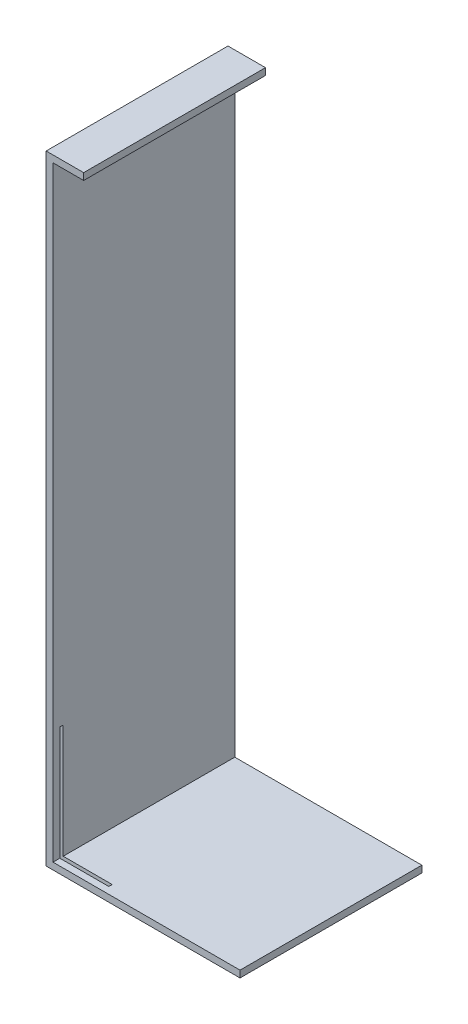
from build123d import *

# Parameters (mm, degrees)
BOSS_EXTRUDE1_DEPTH = 80
SKETCH2_W           = 1.5
SKETCH2_H           = 50
CUT_EXTRUDE1_DEPTH  = 1.5
CUT_EXTRUDE3_DEPTH  = 1.5


with BuildPart() as part:
    # Sketch1 → Boss-Extrude1 (new body)
    with BuildSketch(Plane.XY):
        Polygon((0, 220.664977974), (0, -51.835022026), (85.3, -51.835022026), (85.3, -48.835022026), (3, -48.835022026), (3, 217.664977974), (16.5, 217.664977974), (16.5, 220.664977974), align=None)
    extrude(amount=-BOSS_EXTRUDE1_DEPTH)

    # Sketch2 → Cut-Extrude1 (cut)
    with BuildSketch(Plane(origin=(3, 0, 0), x_dir=(0, 0, -1), z_dir=(1, 0, 0))):
        with Locations((3.75, -23.835022026)):
            Rectangle(SKETCH2_W, SKETCH2_H)
    extrude(amount=-CUT_EXTRUDE1_DEPTH, mode=Mode.SUBTRACT)

    # Sketch3 → Cut-Extrude3 (cut)
    with BuildSketch(Plane(origin=(0, -48.835022026, 0), x_dir=(1, 0, 0), z_dir=(0, 1, 0))):
        Polygon((2.83445579, 3), (24.563412283, 3), (24.563412283, 4.5), (1.5, 4.5), (1.5, 3), align=None)
    extrude(amount=-CUT_EXTRUDE3_DEPTH, mode=Mode.SUBTRACT)


solid = part.part
